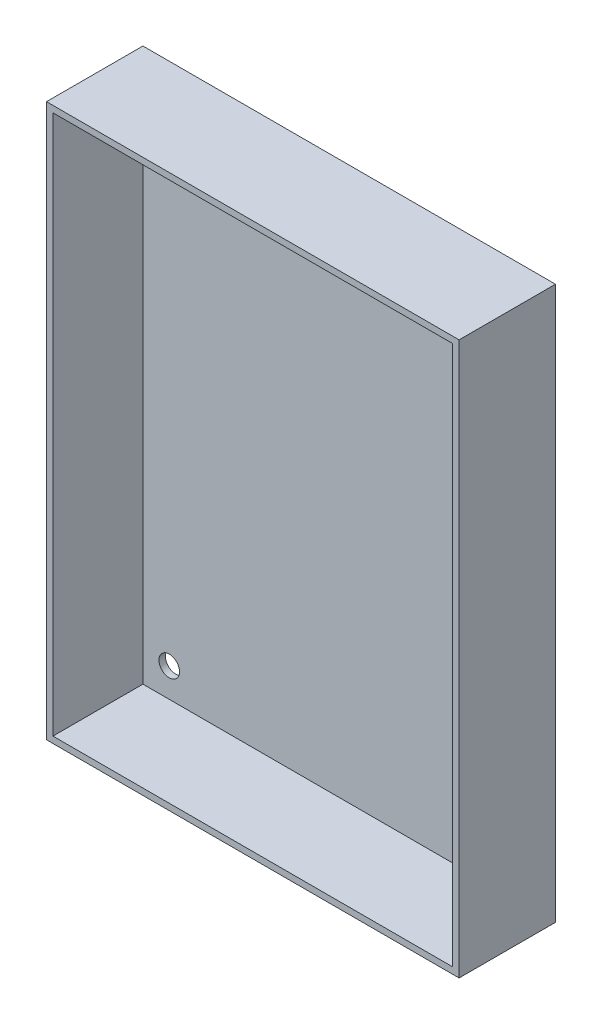
from build123d import *

# Parameters (mm, degrees)
SKETCH_1_W          = 64.2
SKETCH_1_H          = 86
EXTRUDE_1_DEPTH     = 15
SKETCH_2_W          = 62.2
SKETCH_2_H          = 84
CUT_EXTRUDE_1_DEPTH = 14
SKETCH_4_R          = 1.6
CUT_EXTRUDE_2_DEPTH = 1


with BuildPart() as part:
    # Эскиз1 → Бобышка-Вытянуть1 (new body)
    with BuildSketch(Plane.XY):
        Rectangle(SKETCH_1_W, SKETCH_1_H)
    extrude(amount=EXTRUDE_1_DEPTH)

    # Эскиз2 → Вырез-Вытянуть1 (cut)
    with BuildSketch(Plane.XY.offset(15)):
        Rectangle(SKETCH_2_W, SKETCH_2_H)
    extrude(amount=-CUT_EXTRUDE_1_DEPTH, mode=Mode.SUBTRACT)

    # Эскиз4 → Вырез-Вытянуть2 (cut)
    with BuildSketch(Plane(origin=(0, 0, 0), x_dir=(-1, 0, 0), z_dir=(0, 0, -1))):
        with Locations((-27, 37.5)):
            Circle(SKETCH_4_R)
        with Locations((27, 37.5)):
            Circle(SKETCH_4_R)
        with Locations((-27, -37.5)):
            Circle(SKETCH_4_R)
        with Locations((27, -37.5)):
            Circle(SKETCH_4_R)
    extrude(amount=-CUT_EXTRUDE_2_DEPTH, mode=Mode.SUBTRACT)


solid = part.part
